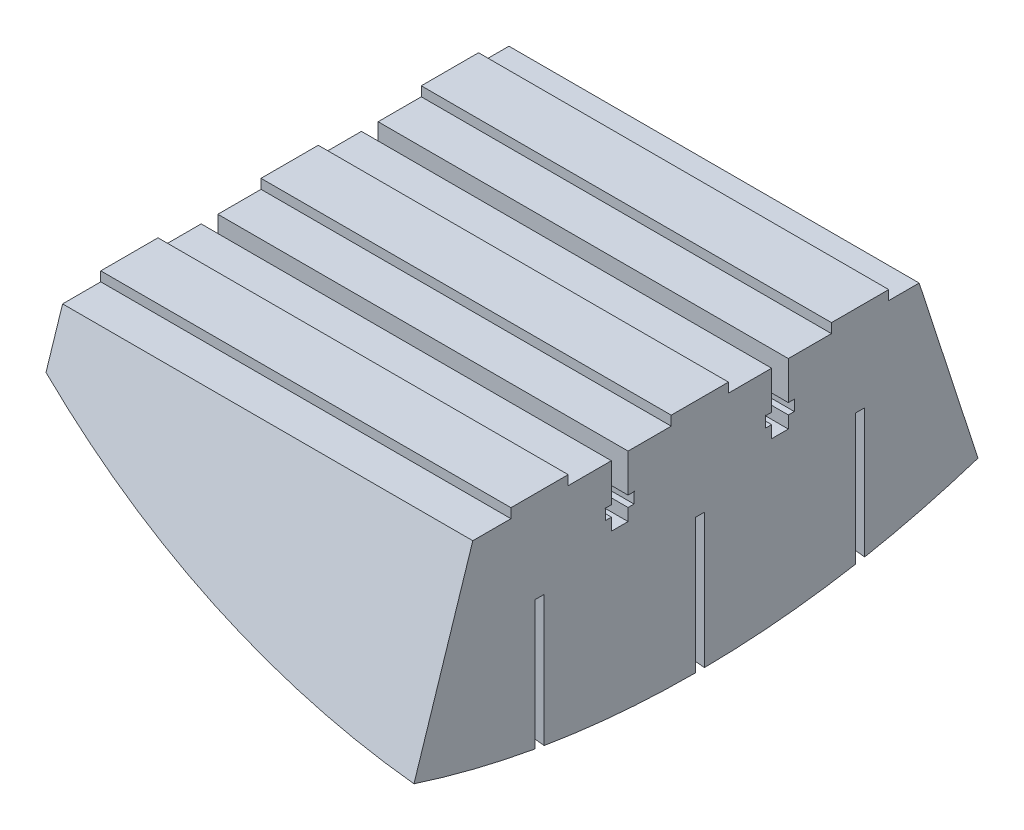
from build123d import *

# Parameters (mm, degrees)
REVOLVE1_ANGLE      = 36
SKETCH2_W           = 185.252199215
SKETCH2_H           = 56.371609172
CUT_EXTRUDE1_DEPTH  = 365.059347887
SKETCH5_W           = 55.655123519
SKETCH5_H           = 148.553285118
CUT_EXTRUDE2_DEPTH  = 235.735844279
SKETCH6_W           = 162.024812579
SKETCH6_H           = 19.05
BOSS_EXTRUDE1_DEPTH = 3.175
LPATTERN1_COUNT     = 3
LPATTERN1_PITCH     = 53.34
CUT_EXTRUDE3_DEPTH  = 357.818950588
LPATTERN2_COUNT     = 2
LPATTERN2_PITCH     = 53.34
SKETCH8_W           = 53.705765401
SKETCH8_H           = 196.003453697
CUT_EXTRUDE4_DEPTH  = 224.765760383
SKETCH10_W          = 3.048
SKETCH10_H          = 86.618344978
SKETCH10_H_2        = 89.651067892
CUT_EXTRUDE6_DEPTH  = 176.53


with BuildPart() as part:
    # Sketch1 → Revolve1 (revolve, symmetric)
    with BuildSketch(Plane.XY) as revolve1_sk:
        with BuildLine():
            Line((-202.80204389, -227.539822875), (-25.4, -227.539822875))
            Line((-25.4, -227.539822875), (-25.4, -303.739822875))
            ThreePointArc((-25.4, -303.739822875), (-120.294028152, -280.057827584), (-202.80204389, -227.539822875))
        make_face()
    revolve(axis=Axis((0, 0, 0), (-1, 0, 0)), revolution_arc=REVOLVE1_ANGLE / 2)
    revolve(revolve1_sk.sketch, axis=Axis((0, 0, 0), (1, 0, 0)), revolution_arc=REVOLVE1_ANGLE / 2)

    # Sketch2 → Cut-Extrude1 (cut, through all)
    with BuildSketch(Plane(origin=(-25.4, 0, 0), x_dir=(0, 0, -1), z_dir=(1, 0, 0))):
        with Locations((3.182919918, -200.414195414)):
            Rectangle(SKETCH2_W, SKETCH2_H)
    extrude(amount=-CUT_EXTRUDE1_DEPTH, mode=Mode.SUBTRACT)

    # Sketch5 → Cut-Extrude2 (cut, through all)
    with BuildSketch(Plane(origin=(0, -228.6, 0), x_dir=(1, 0, 0), z_dir=(0, 1, 0))):
        with Locations((-215.252374339, 0)):
            Rectangle(SKETCH5_W, SKETCH5_H)
    extrude(amount=-CUT_EXTRUDE2_DEPTH, mode=Mode.SUBTRACT)

    # Sketch6 → Boss-Extrude1 (add)
    with BuildSketch(Plane(origin=(0, -228.6, 0), x_dir=(1, 0, 0), z_dir=(0, 1, 0))):
        with Locations((-106.41240629, -52.051642559)):
            Rectangle(SKETCH6_W, SKETCH6_H)
    boss_extrude1 = extrude(amount=BOSS_EXTRUDE1_DEPTH)

    # LPattern1: Boss-Extrude1 ×3
    with Locations(*[(0, 0, -i * LPATTERN1_PITCH) for i in range(1, LPATTERN1_COUNT)]):
        add(boss_extrude1)

    # Sketch7 → Cut-Extrude3 (cut, through all)
    with BuildSketch(Plane(origin=(-25.4, 0, 0), x_dir=(0, 0, -1), z_dir=(1, 0, 0))):
        with BuildLine():
            Line((-22.603517559, -244.856), (-22.603517559, -248.92))
            Line((-22.603517559, -248.92), (-28.159767559, -248.92))
            Line((-28.159767559, -248.92), (-28.159767559, -244.856))
            Line((-28.159767559, -244.856), (-30.144142559, -244.856))
            Line((-30.144142559, -244.856), (-30.144142559, -241.427))
            ThreePointArc((-30.144142559, -241.427), (-30.23394512, -241.210197439), (-30.017142559, -241.3))
            Line((-30.017142559, -241.3), (-28.159767559, -241.3))
            Line((-28.159767559, -241.3), (-28.159767559, -228.6))
            Line((-28.159767559, -228.6), (-22.603517559, -228.6))
            Line((-22.603517559, -228.6), (-22.603517559, -241.3))
            Line((-22.603517559, -241.3), (-20.746142559, -241.3))
            ThreePointArc((-20.746142559, -241.3), (-20.529339998, -241.210197439), (-20.619142559, -241.427))
            Line((-20.619142559, -241.427), (-20.619142559, -244.856))
            Line((-20.619142559, -244.856), (-22.603517559, -244.856))
        make_face()
    cut_extrude3 = extrude(amount=-CUT_EXTRUDE3_DEPTH, mode=Mode.SUBTRACT)

    # LPattern2: Cut-Extrude3 ×2
    with Locations(*[(0, 0, -i * LPATTERN2_PITCH) for i in range(1, LPATTERN2_COUNT)]):
        add(cut_extrude3, mode=Mode.SUBTRACT)

    # Sketch8 → Cut-Extrude4 (cut, through all)
    with BuildSketch(Plane(origin=(0, -225.425, 0), x_dir=(1, 0, 0), z_dir=(0, 1, 0))):
        with Locations((-188.777882701, -12.617417505)):
            Rectangle(SKETCH8_W, SKETCH8_H)
    extrude(amount=-CUT_EXTRUDE4_DEPTH, mode=Mode.SUBTRACT)

    # Sketch10 → Cut-Extrude6 (cut)
    with BuildSketch(Plane(origin=(0, 0, 0), x_dir=(0, 0, -1), z_dir=(1, 0, 0))):
        with Locations((54.628357441, -298.786918327)):
            Rectangle(SKETCH10_W, SKETCH10_H)
        with Locations((1.288357441, -303.737090483)):
            Rectangle(SKETCH10_W, SKETCH10_H_2)
        with Locations((-52.051642559, -299.246564737)):
            Rectangle(SKETCH10_W, SKETCH10_H)
    extrude(amount=-CUT_EXTRUDE6_DEPTH, mode=Mode.SUBTRACT)


solid = part.part
